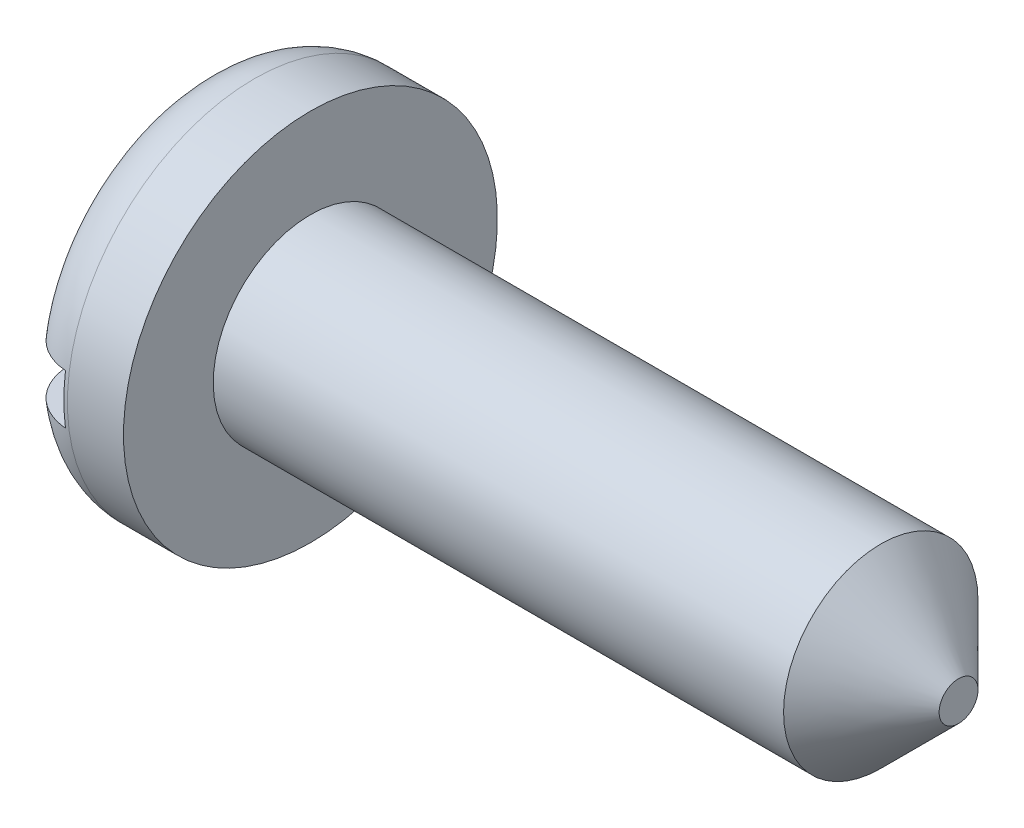
from build123d import *

# Parameters (mm, degrees)
CUT_EXTRUDE1_DEPTH      = 17.145819892
CUT_EXTRUDE1_DEPTH_BACK = 17.145819892
SKETCH2_W               = 1.05
SKETCH2_H               = 1


with BuildPart() as part:
    # Sketch1 → Revolve1 (revolve)
    with BuildSketch(Plane.XY):
        with BuildLine():
            Line((0, 0), (0, 2.625))
            ThreePointArc((0, 2.625), (0.329504871, 3.420495129), (1.125, 3.75))
            Line((1.125, 3.75), (2.25, 3.75))
            Line((2.25, 3.75), (2.25, 1.95))
            Line((2.25, 1.95), (13.69, 1.95))
            Line((13.69, 1.95), (15.25, 0.39))
            Line((15.25, 0.39), (15.25, 0))
            Line((15.25, 0), (0, 0))
        make_face()
    revolve(axis=Axis((15.25, 0, 0), (-1, 0, 0)))

    # Sketch2 → Cut-Extrude1 (cut, two sides: drawn at the far end of the back side and taken through both)
    with BuildSketch(Plane.XY.offset(-CUT_EXTRUDE1_DEPTH_BACK)):
        with Locations((0.525, 0)):
            Rectangle(SKETCH2_W, SKETCH2_H)
    extrude(amount=CUT_EXTRUDE1_DEPTH + CUT_EXTRUDE1_DEPTH_BACK, mode=Mode.SUBTRACT)


solid = part.part
